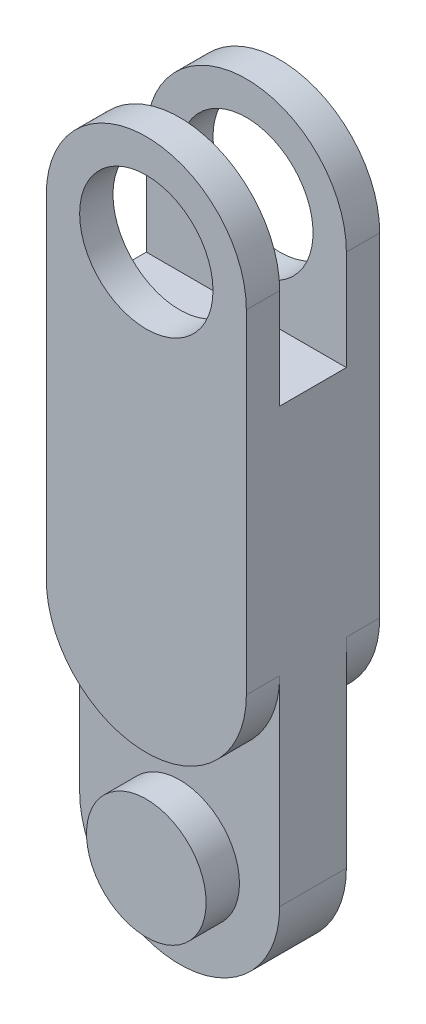
from build123d import *

# Parameters (mm, degrees)
CROQUIS1_R                 = 10
SALIENTE_EXTRUIR1_DEPTH    = 10
CORTAR_EXTRUIR2_DEPTH      = 97.695398029
CORTAR_EXTRUIR2_DEPTH_BACK = 97.695398029
CROQUIS2_W                 = 10
CROQUIS2_H                 = 30
CORTAR_EXTRUIR4_START      = -5
CROQUIS4_R                 = 8.968507367
CORTAR_EXTRUIR4_DEPTH      = 92.695398029
CORTAR_EXTRUIR6_START      = 5
CROQUIS4_2_R               = 8.968507367
CORTAR_EXTRUIR6_DEPTH      = 92.695398029


with BuildPart() as part:
    # Croquis1 → Saliente-Extruir1 (new, symmetric)
    with BuildSketch(Plane.XY):
        with BuildLine():
            Line((-15, 0), (-15, 80))
            ThreePointArc((-15, 80), (0, 95), (15, 80))
            Line((15, 80), (15, 0))
            ThreePointArc((15, 0), (0, -15), (-15, 0))
        make_face()
        with Locations((0, 80)):
            Circle(CROQUIS1_R, mode=Mode.SUBTRACT)
    extrude(amount=SALIENTE_EXTRUIR1_DEPTH, both=True)

    # Croquis2 → Cortar-Extruir2 (cut, two sides: drawn at the far end of the back side and taken through both)
    with BuildSketch(Plane(origin=(0, 0, 0), x_dir=(0, 0, -1), z_dir=(1, 0, 0)).offset(-CORTAR_EXTRUIR2_DEPTH_BACK)):
        with Locations((0, 80)):
            Rectangle(CROQUIS2_W, CROQUIS2_H)
    extrude(amount=CORTAR_EXTRUIR2_DEPTH + CORTAR_EXTRUIR2_DEPTH_BACK, mode=Mode.SUBTRACT)

    # Croquis4 → Cortar-Extruir4 (cut, through all)
    with BuildSketch(Plane.XY.offset(CORTAR_EXTRUIR4_START)):
        with BuildLine():
            Line((-15, 30), (-15, 0))
            ThreePointArc((-15, 0), (0, -15), (15, 0))
            Line((15, 0), (15, 30))
            ThreePointArc((15, 30), (0, 15), (-15, 30))
        make_face()
        Circle(CROQUIS4_R, mode=Mode.SUBTRACT)
    extrude(amount=-CORTAR_EXTRUIR4_DEPTH, mode=Mode.SUBTRACT)

    # Croquis4<2> → Cortar-Extruir6 (cut, through all)
    with BuildSketch(Plane.XY.offset(CORTAR_EXTRUIR6_START)):
        with BuildLine():
            Line((-15, 30), (-15, 0))
            ThreePointArc((-15, 0), (0, -15), (15, 0))
            Line((15, 0), (15, 30))
            ThreePointArc((15, 30), (0, 15), (-15, 30))
        make_face()
        Circle(CROQUIS4_2_R, mode=Mode.SUBTRACT)
    extrude(amount=CORTAR_EXTRUIR6_DEPTH, mode=Mode.SUBTRACT)


solid = part.part
